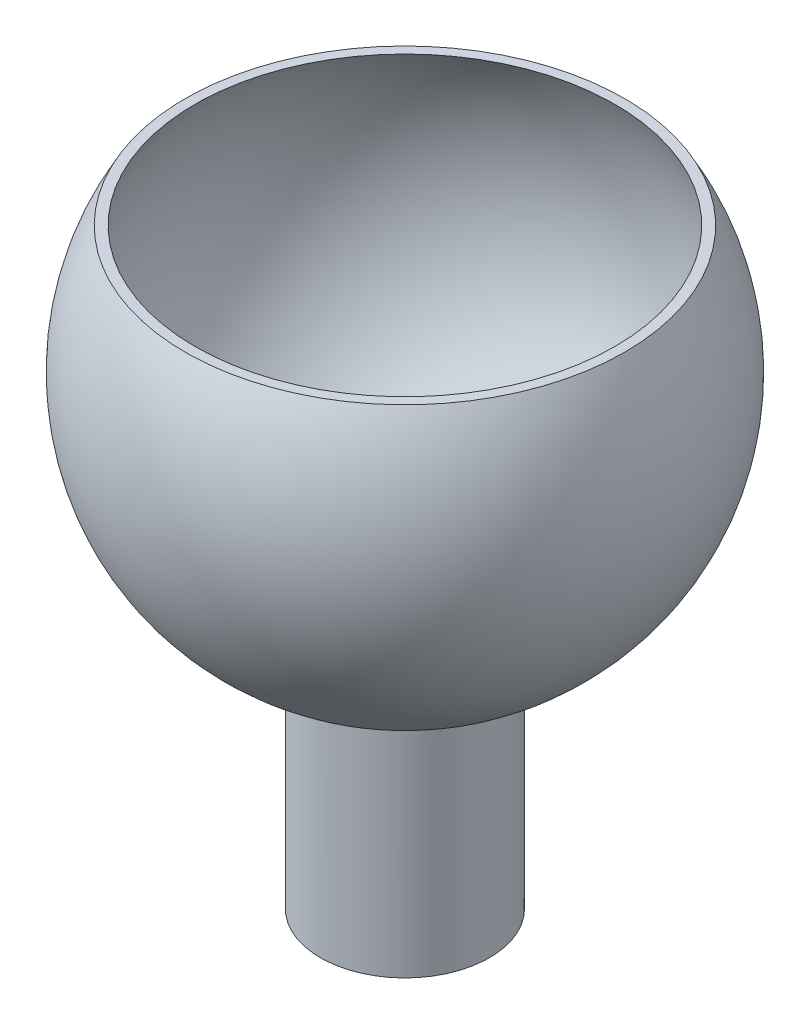
from build123d import *

# Parameters (mm, degrees)
CUT_EXTRUDE1_DEPTH      = 52.961524227
CUT_EXTRUDE1_DEPTH_BACK = 52.961524227
SHELL1_T                = -1


with BuildPart() as part:
    # Sketch1 → Revolve1 (revolve)
    with BuildSketch(Plane.XY):
        with BuildLine():
            Line((0, 30), (0, -30))
            ThreePointArc((0, -30), (30, 0), (0, 30))
        make_face()
    revolve(axis=Axis((0, 30, 0), (0, -1, 0)))

    # Sketch2 → Cut-Extrude1 (cut, two sides: drawn at the far end of the back side and taken through both)
    with BuildSketch(Plane.XY.offset(-CUT_EXTRUDE1_DEPTH_BACK)):
        Polygon((-219.842197388, 15), (-39.041394336, 15), (42.58256389, 15), (223.383366942, 15), (223.383366942, 376.601606104), (-219.842197388, 376.601606104), align=None)
    extrude(amount=CUT_EXTRUDE1_DEPTH + CUT_EXTRUDE1_DEPTH_BACK, mode=Mode.SUBTRACT)

    # Shell1
    shell1_openings = [part.faces().sort_by_distance(p)[0] for p in [
        (0, 15, 0),
    ]]
    offset(amount=SHELL1_T, openings=shell1_openings, kind=Kind.INTERSECTION)

    # Sketch3 → Revolve2 (revolve)
    with BuildSketch(Plane.XY):
        with BuildLine():
            Line((0, -30), (0, -55))
            Line((0, -55), (10, -55))
            Line((10, -55), (10, -28.284271247))
            ThreePointArc((10, -28.284271247), (5.073059362, -29.56795679), (0, -30))
        make_face()
    revolve(axis=Axis((0, -30, 0), (0, -1, 0)))


solid = part.part
